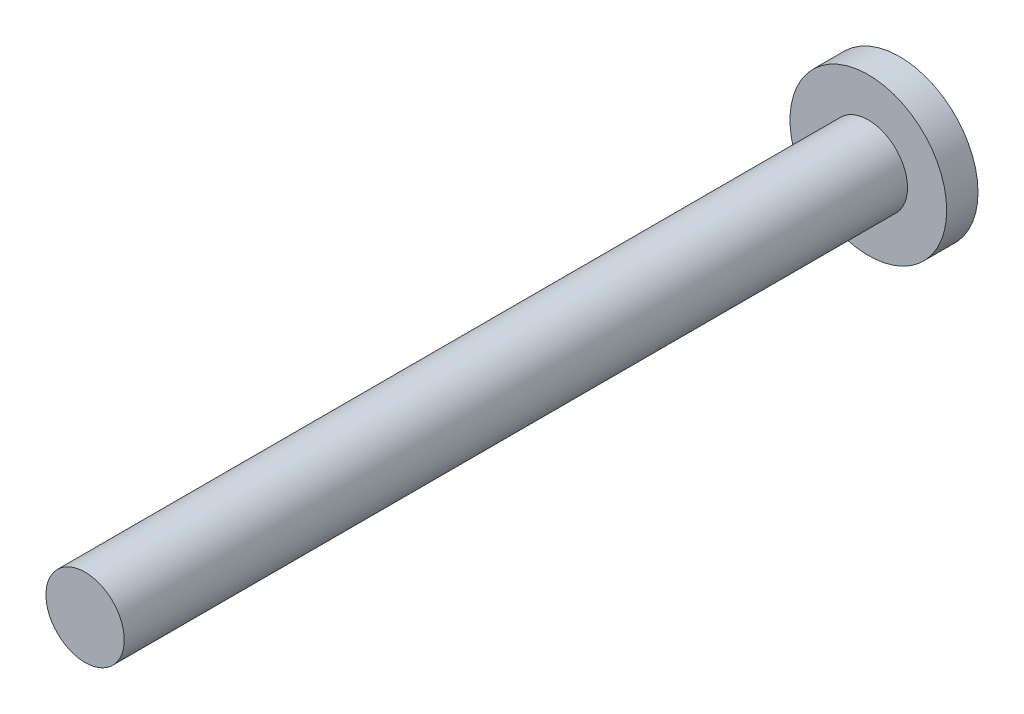
from build123d import *


with BuildPart() as part:
    # Sketch1 → Revolve1 (revolve)
    with BuildSketch(Plane(origin=(0, 0, 0), x_dir=(1, 0, 0), z_dir=(0, 1, 0))):
        Polygon((0, 0), (0, 52), (5, 52), (5, 50), (2.5, 50), (2.5, 0), align=None)
    revolve(axis=Axis((0, 0, 0), (0, 0, -1)))


solid = part.part
